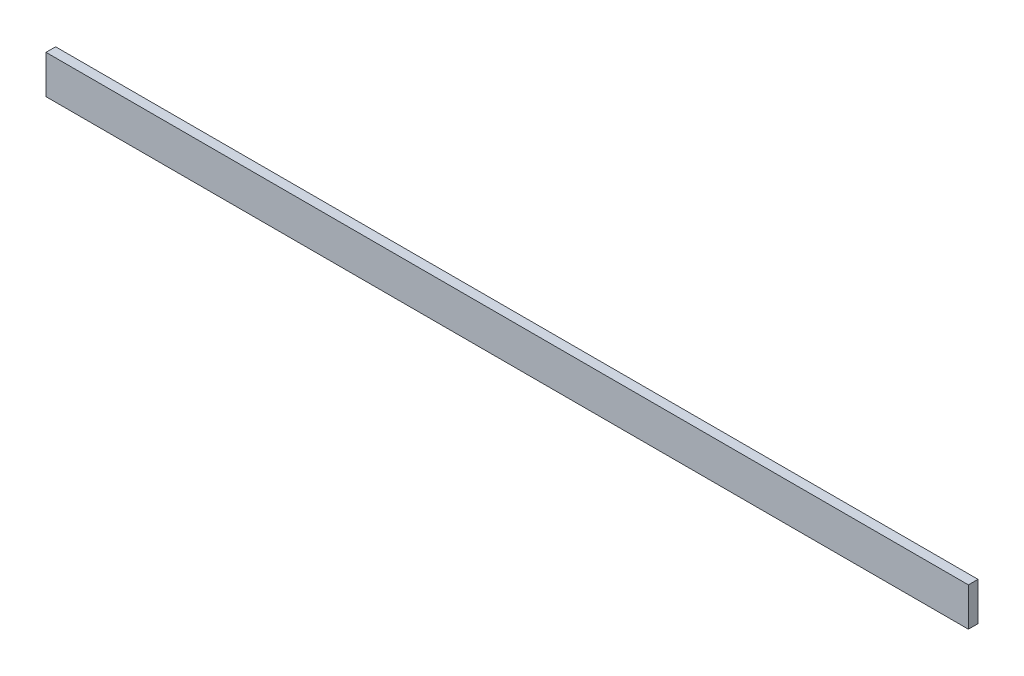
from build123d import *

# Parameters (mm, degrees)
SKETCH1_W           = 2438.4
SKETCH1_H           = 101.6
BOSS_EXTRUDE1_DEPTH = 25.4


with BuildPart() as part:
    # Sketch1 → Boss-Extrude1 (new body)
    with BuildSketch(Plane.XY):
        with Locations((1007.002724796, 43.325340599)):
            Rectangle(SKETCH1_W, SKETCH1_H)
    extrude(amount=BOSS_EXTRUDE1_DEPTH)


solid = part.part
